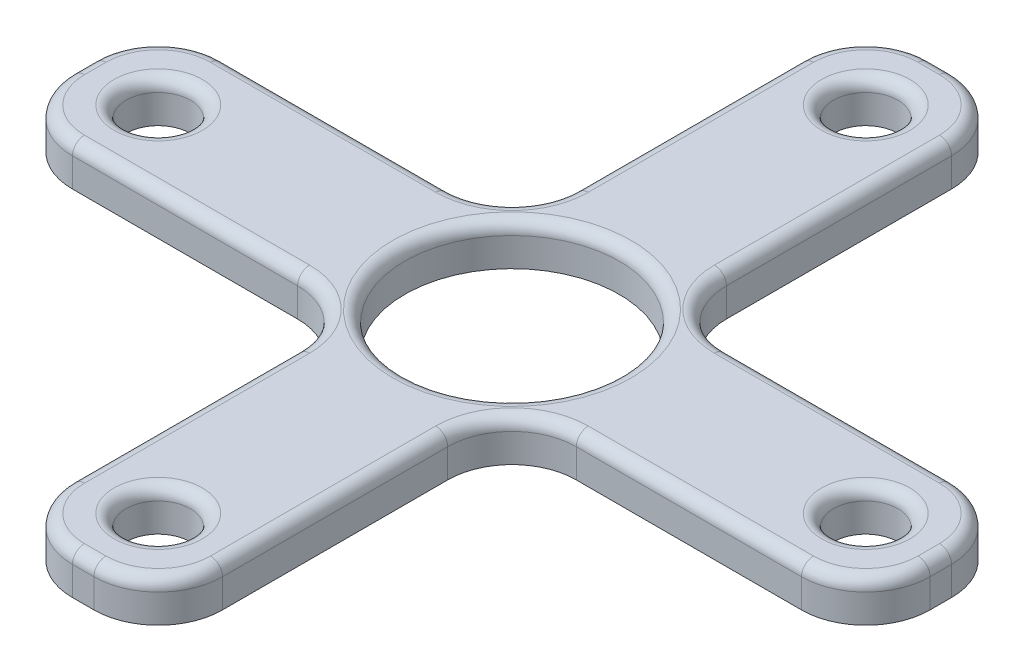
from build123d import *

# Parameters (mm, degrees)
SKETCH1_R           = 1.5
BOSS_EXTRUDE1_DEPTH = 1.9
FILLET1_R           = 3
FILLET3_R           = 3
SKETCH2_R           = 5
CUT_EXTRUDE1_DEPTH  = 1.9
FILLET5_R           = 0.56


with BuildPart() as part:
    # Sketch1 → Boss-Extrude1 (new body)
    with BuildSketch(Plane(origin=(0, 0, 0), x_dir=(1, 0, 0), z_dir=(0, 1, 0))):
        Polygon((-7.139227625, 20), (-3.639227625, 20), (-3.639227625, 3.5), (12.860772375, 3.5), (12.860772375, 0), (12.860772375, -3.5), (-3.639227625, -3.5), (-3.639227625, -20), (-7.139227625, -20), (-10.639227625, -20), (-10.639227625, -3.5), (-27.139227625, -3.5), (-27.139227625, 0), (-27.139227625, 3.5), (-10.639227625, 3.5), (-10.639227625, 20), align=None)
        with Locations(Location((-23.639227625, 0, 0), (0, 0, 90))):
            Circle(SKETCH1_R, mode=Mode.SUBTRACT)
        with Locations(Location((-7.139227625, 16.5, 0), (0, 0, 90))):
            Circle(SKETCH1_R, mode=Mode.SUBTRACT)
        with Locations(Location((9.360772375, 0, 0), (0, 0, 90))):
            Circle(SKETCH1_R, mode=Mode.SUBTRACT)
        with Locations(Location((-7.139227625, -16.5, 0), (0, 0, 90))):
            Circle(SKETCH1_R, mode=Mode.SUBTRACT)
    extrude(amount=BOSS_EXTRUDE1_DEPTH)

    # Fillet1
    fillet1_edges = [part.edges().sort_by_distance(p)[0] for p in [
        (-27.139227625, 0.95, -3.5),
        (-10.639227625, 0.95, -20),
        (-3.639227625, 0.95, -20),
        (12.860772375, 0.95, -3.5),
        (12.860772375, 0.95, 3.5),
        (-3.639227625, 0.95, 20),
        (-10.639227625, 0.95, 20),
        (-27.139227625, 0.95, 3.5),
    ]]
    fillet(fillet1_edges, radius=FILLET1_R)

    # Fillet3
    fillet3_edges = [part.edges().sort_by_distance(p)[0] for p in [
        (-10.639227625, 0.95, -3.5),
        (-3.639227625, 0.95, -3.5),
        (-3.639227625, 0.95, 3.5),
        (-10.639227625, 0.95, 3.5),
    ]]
    fillet(fillet3_edges, radius=FILLET3_R)

    # Sketch2 → Cut-Extrude1 (cut)
    with BuildSketch(Plane(origin=(0, 1.9, 0), x_dir=(1, 0, 0), z_dir=(0, 1, 0))):
        with Locations(Location((-7.139227625, 0, 0), (0, 0, 270))):
            Circle(SKETCH2_R)
    extrude(amount=-CUT_EXTRUDE1_DEPTH, mode=Mode.SUBTRACT)

    # Fillet5
    fillet5_edges = [part.edges().sort_by_distance(p)[0] for p in [
        (-3.639227625, 1.9, -11.75),
        (-18.889227625, 1.9, -3.5),
        (-10.639227625, 1.9, 11.75),
        (4.610772375, 1.9, 3.5),
        (-2.760547968, 1.9, -4.378679656),
        (-11.517907281, 1.9, -4.378679656),
        (-11.517907281, 1.9, 4.378679656),
        (-2.760547968, 1.9, 4.378679656),
        (-7.139227625, 1.9, -5),
        (-23.639227625, 1.9, 1.5),
        (-7.139227625, 1.9, -15),
        (9.360772375, 1.9, 1.5),
        (-7.139227625, 1.9, 18),
        (-18.889227625, 1.9, 3.5),
        (-27.139227625, 1.9, 0),
        (-7.139227625, 1.9, 20),
        (-3.639227625, 1.9, 11.75),
        (12.860772375, 1.9, 0),
        (4.610772375, 1.9, -3.5),
        (-7.139227625, 1.9, -20),
        (-10.639227625, 1.9, -11.75),
        (-4.517907281, 1.9, 19.121320344),
        (-9.760547968, 1.9, 19.121320344),
        (11.982092719, 1.9, 2.621320344),
        (11.982092719, 1.9, -2.621320344),
        (-4.517907281, 1.9, -19.121320344),
        (-9.760547968, 1.9, -19.121320344),
        (-26.260547968, 1.9, -2.621320344),
        (-26.260547968, 1.9, 2.621320344),
    ]]
    fillet(fillet5_edges, radius=FILLET5_R)


solid = part.part
